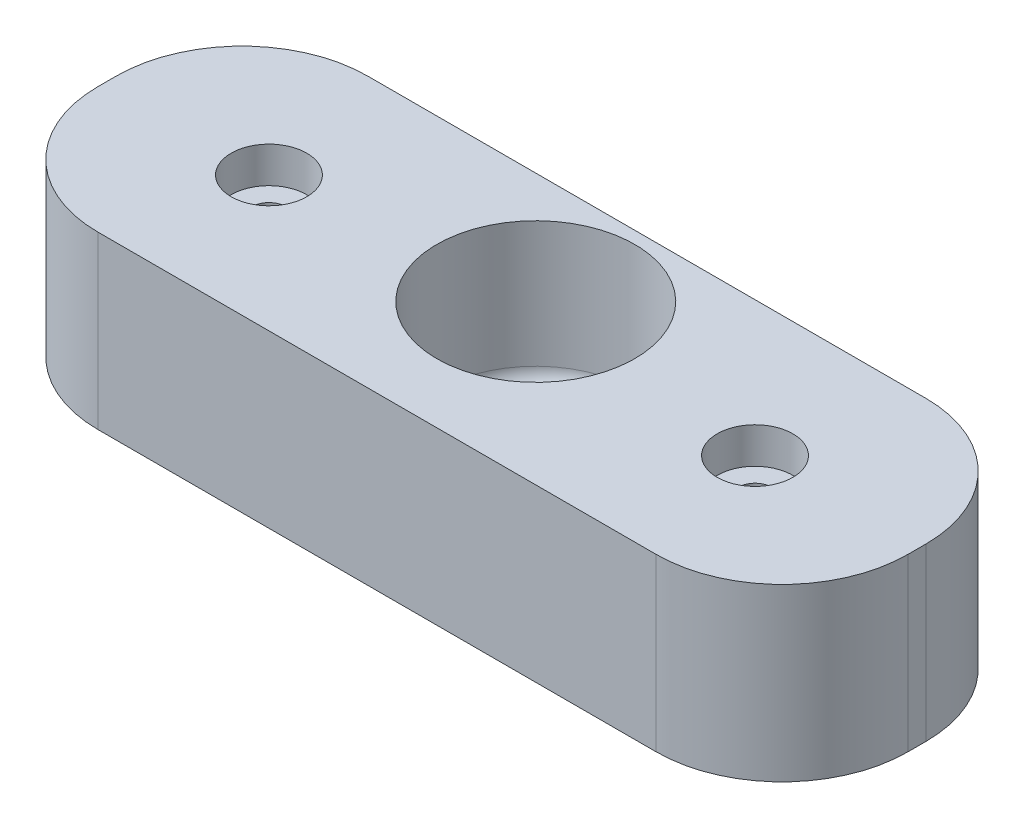
from build123d import *

# Parameters (mm, degrees)
SKETCH1_W           = 45
SKETCH1_H           = 15
BOSS_EXTRUDE1_DEPTH = 9.5
SKETCH2_R           = 5.5
CUT_EXTRUDE1_DEPTH  = 8
CUT_EXTRUDE2_REACH  = 50.104
SKETCH3_R           = 2.2
SKETCH4_R           = 2.1
CUT_EXTRUDE3_DEPTH  = 2
FILLET1_R           = 7
SKETCH5_R           = 2.05
CUT_EXTRUDE4_DEPTH  = 5
SKETCH6_R           = 0.95
CUT_EXTRUDE5_DEPTH  = 3
FILLET5_R           = 1


with BuildPart() as part:
    # Sketch1 → Boss-Extrude1 (new body)
    with BuildSketch(Plane(origin=(0, 0, 0), x_dir=(1, 0, 0), z_dir=(0, 1, 0))):
        with Locations((22.5, 7.5)):
            Rectangle(SKETCH1_W, SKETCH1_H)
    extrude(amount=-BOSS_EXTRUDE1_DEPTH)

    # Sketch2 → Cut-Extrude1 (cut)
    with BuildSketch(Plane(origin=(0, 0, 0), x_dir=(1, 0, 0), z_dir=(0, 1, 0))):
        with Locations(Location((22.5, 8.82, 0), (0, 0, 270))):
            Circle(SKETCH2_R)
    extrude(amount=-CUT_EXTRUDE1_DEPTH, mode=Mode.SUBTRACT)

    # Sketch3 → Cut-Extrude2 (cut, up to next)
    with BuildSketch(Plane(origin=(0, -8, 0), x_dir=(1, 0, 0), z_dir=(0, 1, 0)), mode=Mode.PRIVATE) as cut_extrude2_sk1:
        with Locations(Location((22.5, 8.82, 0), (0, 0, 270))):
            Circle(SKETCH3_R)
    cut_extrude2_tool1 = extrude(cut_extrude2_sk1.sketch, amount=-CUT_EXTRUDE2_REACH, mode=Mode.PRIVATE) & part.part
    add(cut_extrude2_tool1.solids().sort_by_distance((22.5, -8, -8.82))[0], mode=Mode.SUBTRACT)

    # Sketch4 → Cut-Extrude3 (cut)
    with BuildSketch(Plane(origin=(0, 0, 0), x_dir=(1, 0, 0), z_dir=(0, 1, 0))):
        with Locations(Location((9, 7.5, 0), (0, 0, 270))):
            Circle(SKETCH4_R)
        with Locations(Location((36, 7.5, 0), (0, 0, 270))):
            Circle(SKETCH4_R)
    extrude(amount=-CUT_EXTRUDE3_DEPTH, mode=Mode.SUBTRACT)

    # Fillet1
    fillet1_edges = [part.edges().sort_by_distance(p)[0] for p in [
        (0, -4.75, -15),
        (45, -4.75, -15),
        (45, -4.75, 0),
        (0, -4.75, 0),
    ]]
    fillet(fillet1_edges, radius=FILLET1_R)

    # Sketch5 → Cut-Extrude4 (cut)
    with BuildSketch(Plane(origin=(0, -9.5, 0), x_dir=(-1, 0, 0), z_dir=(0, -1, 0))):
        with Locations(Location((-36, 7.5, 0), (0, 0, 90))):
            Circle(SKETCH5_R)
        with Locations(Location((-9, 7.5, 0), (0, 0, 90))):
            Circle(SKETCH5_R)
    extrude(amount=-CUT_EXTRUDE4_DEPTH, mode=Mode.SUBTRACT)

    # Sketch6 → Cut-Extrude5 (cut)
    with BuildSketch(Plane(origin=(0, -2, 0), x_dir=(1, 0, 0), z_dir=(0, 1, 0))):
        with Locations(Location((9, 7.5, 0), (0, 0, 270))):
            Circle(SKETCH6_R)
        with Locations(Location((36, 7.5, 0), (0, 0, 270))):
            Circle(SKETCH6_R)
    extrude(amount=-CUT_EXTRUDE5_DEPTH, mode=Mode.SUBTRACT)

    # Fillet5
    fillet5_edges = [part.edges().sort_by_distance(p)[0] for p in [
        (22.5, -8, -14.32),
        (22.5, -8, -11.02),
    ]]
    fillet(fillet5_edges, radius=FILLET5_R)


solid = part.part
